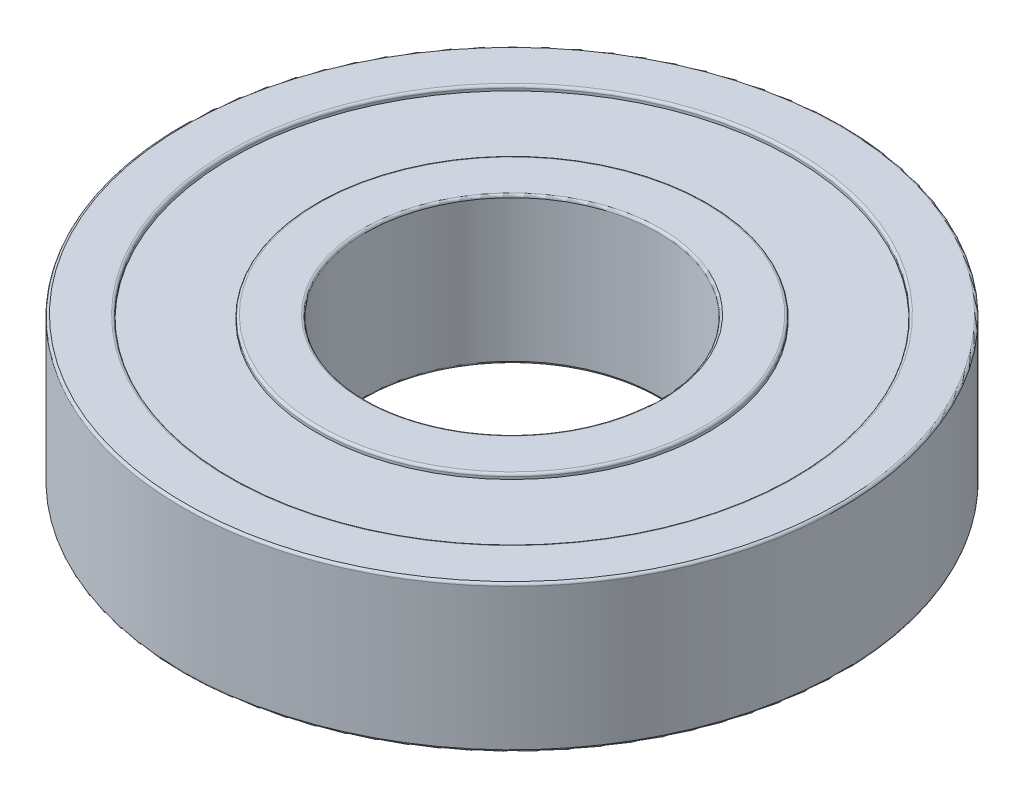
from build123d import *

# Parameters (mm, degrees)
SKETCH3_W = 2.75
SKETCH3_H = 0.1
FILLET1_R = 0.05
FILLET2_R = 0.05


with BuildPart() as part:
    # Sketch1 → Revolve1 (revolve)
    with BuildSketch(Plane.XY, mode=Mode.PRIVATE) as revolve1_sk:
        with BuildLine():
            Line((-6.75, 1.5), (-5.75, 1.5))
            Line((-5.75, 1.5), (-5.75, 0.85))
            ThreePointArc((-5.75, 0.85), (-6.014079291, 0), (-5.75, -0.85))
            Line((-5.75, -0.85), (-5.75, -1.5))
            Line((-5.75, -1.5), (-6.75, -1.5))
            Line((-6.75, -1.5), (-6.75, 1.5))
        make_face()
        with BuildLine():
            Line((-4, -1.5), (-4, -0.85))
            ThreePointArc((-4, -0.85), (-3.735920709, 0), (-4, 0.85))
            Line((-4, 0.85), (-4, 1.5))
            Line((-4, 1.5), (-3, 1.5))
            Line((-3, 1.5), (-3, -1.5))
            Line((-3, -1.5), (-4, -1.5))
        make_face()
    revolve(revolve1_sk.sketch.rotate(Axis((0, 0, 0), (0, 1, 0)), 270), axis=Axis((0, 0, 0), (0, 1, 0)))

    # Sketch3 → Revolve3 (revolve)
    with BuildSketch(Plane.XY, mode=Mode.PRIVATE) as revolve3_sk:
        with Locations((-4.375, 1.35)):
            Rectangle(SKETCH3_W, SKETCH3_H)
        with Locations((-4.375, -1.35)):
            Rectangle(SKETCH3_W, SKETCH3_H)
    revolve(revolve3_sk.sketch.rotate(Axis((0, 0, 0), (0, 1, 0)), 270), axis=Axis((0, 0, 0), (0, 1, 0)))

    # Fillet1
    fillet1_edges = [part.edges().sort_by_distance(p)[0] for p in [
        (0, -1.5, 6.75),
        (0, -1.5, 5.75),
        (0, 1.5, 5.75),
        (0, 1.5, 6.75),
    ]]
    fillet(fillet1_edges, radius=FILLET1_R)

    # Fillet2
    fillet2_edges = [part.edges().sort_by_distance(p)[0] for p in [
        (0, -1.5, 3),
        (0, 1.5, 4),
        (0, -1.5, 4),
        (0, 1.5, 3),
    ]]
    fillet(fillet2_edges, radius=FILLET2_R)


solid = part.part
